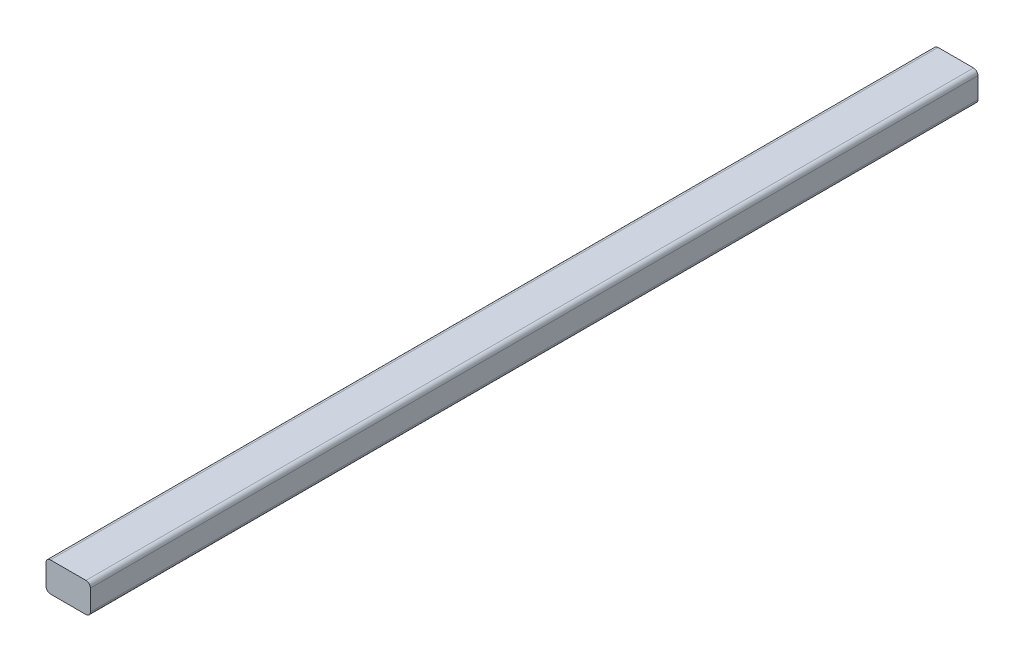
from build123d import *

# Parameters (mm, degrees)
ESQUISSE1_W        = 30
ESQUISSE1_H        = 20
BOSS_EXTRU_1_DEPTH = 600
CONG_1_R           = 3


with BuildPart() as part:
    # Esquisse1 → Boss.-Extru.1 (new body)
    with BuildSketch(Plane.XY):
        with Locations((15, 10)):
            Rectangle(ESQUISSE1_W, ESQUISSE1_H)
    extrude(amount=BOSS_EXTRU_1_DEPTH)

    # Congé1
    cong_1_edges = [part.edges().sort_by_distance(p)[0] for p in [
        (0, 20, 300),
        (30, 20, 300),
        (30, 0, 300),
        (0, 0, 300),
    ]]
    fillet(cong_1_edges, radius=CONG_1_R)


solid = part.part
